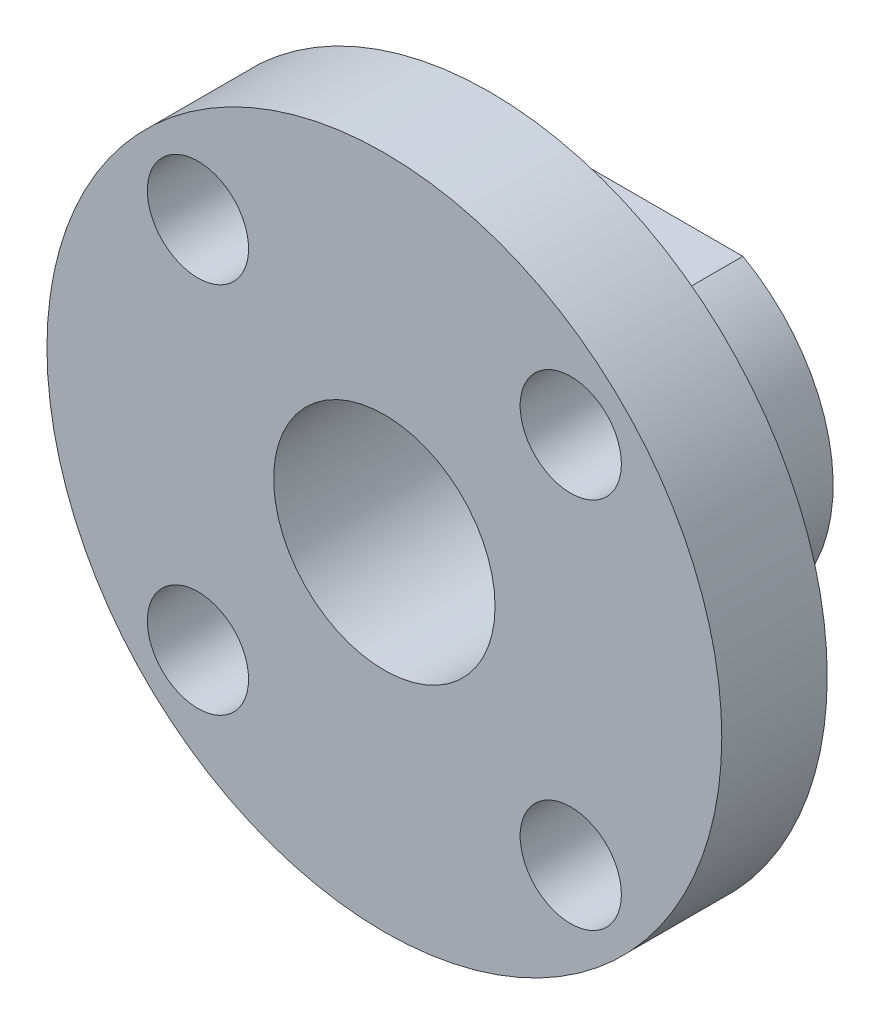
from build123d import *

# Parameters (mm, degrees)
SKETCH12_R              = 16
BOSS_EXTRUDE3_DEPTH     = 5
CUT_EXTRUDE3_REACH      = 25.173
SKETCH14_R              = 2.4
BOSS_EXTRUDE4_DEPTH     = 8
SKETCH15_R              = 5.25
CUT_EXTRUDE4_DEPTH      = 10
CUT_EXTRUDE5_REACH      = 31.335
CUT_EXTRUDE5_END_RADIUS = 5.25
SKETCH17_R              = 2.4


with BuildPart() as part:
    # Sketch12 → Boss-Extrude3 (new body)
    with BuildSketch(Plane.XY):
        Circle(SKETCH12_R)
    extrude(amount=BOSS_EXTRUDE3_DEPTH)

    # Sketch14 → Cut-Extrude3 (cut, up to next)
    with BuildSketch(Plane.XY, mode=Mode.PRIVATE) as cut_extrude3_sk1:
        with Locations((8.838834765, 8.838834765)):
            Circle(SKETCH14_R)
    cut_extrude3_tool1 = extrude(cut_extrude3_sk1.sketch, amount=CUT_EXTRUDE3_REACH, mode=Mode.PRIVATE) & part.part
    # Sketch14 → Cut-Extrude3 (cut, up to next)
    with BuildSketch(Plane.XY, mode=Mode.PRIVATE) as cut_extrude3_sk2:
        with Locations((-8.838834765, 8.838834765)):
            Circle(SKETCH14_R)
    cut_extrude3_tool2 = extrude(cut_extrude3_sk2.sketch, amount=CUT_EXTRUDE3_REACH, mode=Mode.PRIVATE) & part.part
    # Sketch14 → Cut-Extrude3 (cut, up to next)
    with BuildSketch(Plane.XY, mode=Mode.PRIVATE) as cut_extrude3_sk3:
        with Locations((8.838834765, -8.838834765)):
            Circle(SKETCH14_R)
    cut_extrude3_tool3 = extrude(cut_extrude3_sk3.sketch, amount=CUT_EXTRUDE3_REACH, mode=Mode.PRIVATE) & part.part
    # Sketch14 → Cut-Extrude3 (cut, up to next)
    with BuildSketch(Plane.XY, mode=Mode.PRIVATE) as cut_extrude3_sk4:
        with Locations((-8.838834765, -8.838834765)):
            Circle(SKETCH14_R)
    cut_extrude3_tool4 = extrude(cut_extrude3_sk4.sketch, amount=CUT_EXTRUDE3_REACH, mode=Mode.PRIVATE) & part.part
    add(cut_extrude3_tool1.solids().sort_by_distance((8.838835, 8.838835, 0))[0], mode=Mode.SUBTRACT)
    add(cut_extrude3_tool2.solids().sort_by_distance((-8.838835, 8.838835, 0))[0], mode=Mode.SUBTRACT)
    add(cut_extrude3_tool3.solids().sort_by_distance((8.838835, -8.838835, 0))[0], mode=Mode.SUBTRACT)
    add(cut_extrude3_tool4.solids().sort_by_distance((-8.838835, -8.838835, 0))[0], mode=Mode.SUBTRACT)

    # Sketch16 → Boss-Extrude4 (add)
    with BuildSketch(Plane.XY):
        with BuildLine():
            Line((4, 7.25), (-4, 7.25))
            ThreePointArc((-4, 7.25), (0, -8.280247581), (4, 7.25))
        make_face()
    extrude(amount=-BOSS_EXTRUDE4_DEPTH)

    # Sketch15 → Cut-Extrude4 (cut, symmetric)
    with BuildSketch(Plane.XY):
        Circle(SKETCH15_R)
    extrude(amount=CUT_EXTRUDE4_DEPTH, both=True, mode=Mode.SUBTRACT)

    # Cut-Extrude5: up to this cylinder (the profile starts outside it)
    cut_extrude5_end = Plane(origin=(0, 0, -4), z_dir=(0, 0, 1)) * Cylinder(CUT_EXTRUDE5_END_RADIUS, 74.17, mode=Mode.PRIVATE)
    # Sketch17 → Cut-Extrude5 (cut, up to the surface)
    with BuildSketch(Plane(origin=(0, 7.25, 0), x_dir=(1, 0, 0), z_dir=(0, 1, 0)), mode=Mode.PRIVATE) as cut_extrude5_sk1:
        with Locations(Location((0, 4, 0), (0, 0, 270))):
            Circle(SKETCH17_R)
    cut_extrude5_tool1 = extrude(cut_extrude5_sk1.sketch, amount=-CUT_EXTRUDE5_REACH, mode=Mode.PRIVATE) - cut_extrude5_end
    add(cut_extrude5_tool1.solids().sort_by_distance((0, 7.25, -4))[0], mode=Mode.SUBTRACT)


solid = part.part
